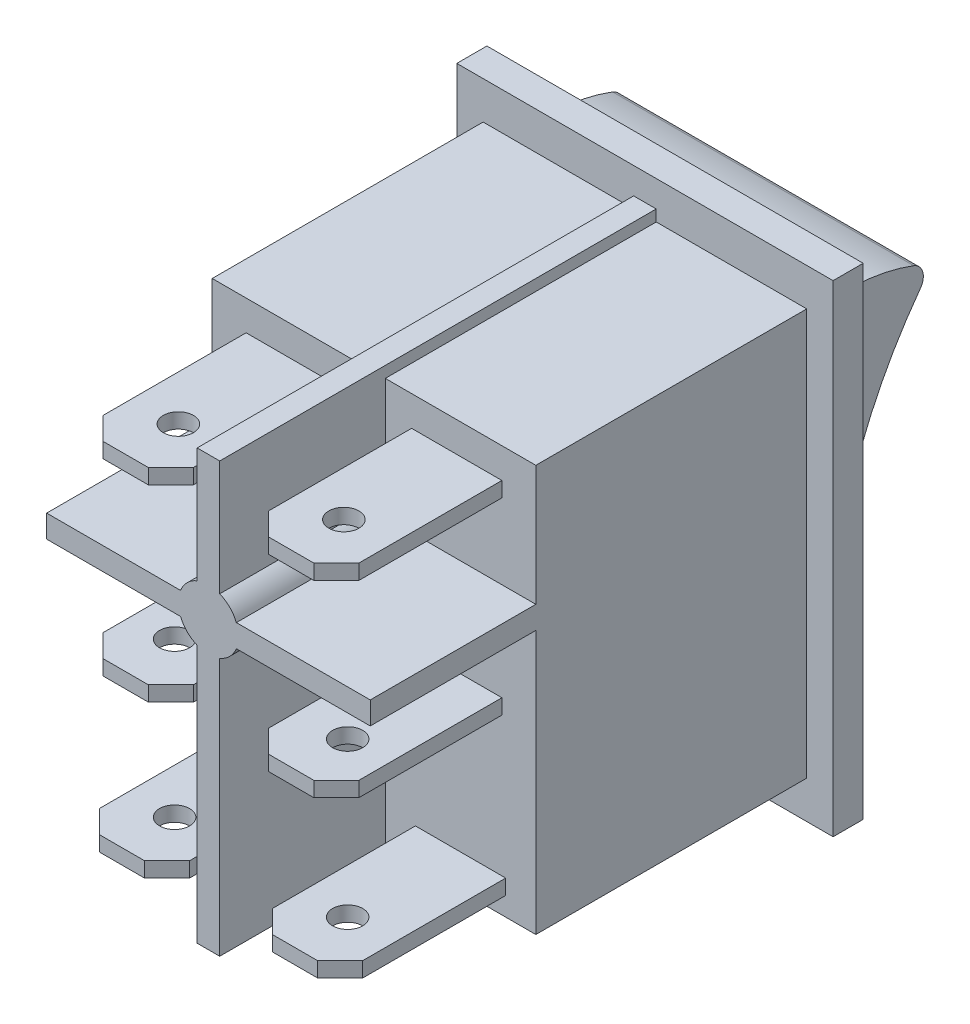
from build123d import *

# Parameters (mm, degrees)
SKETCH_1_W          = 25
SKETCH_1_H          = 32
EXTRUDE_1_DEPTH     = 2
SKETCH_2_W          = 21.5
SKETCH_2_H          = 27
EXTRUDE_2_DEPTH     = 18
SKETCH_3_W          = 1.5
SKETCH_3_H          = 28.5
EXTRUDE_3_DEPTH     = 29
SKETCH_4_W          = 21.5
SKETCH_4_H          = 1.5
EXTRUDE_4_DEPTH     = 11
SKETCH_6_R          = 2
EXTRUDE_5_DEPTH     = 11
SKETCH_7_W          = 6
SKETCH_7_H          = 1
EXTRUDE_6_DEPTH     = 11
SKETCH_8_R          = 1
CUT_EXTRUDE_1_DEPTH = 15
SKETCH_9_R          = 1
CUT_EXTRUDE_2_DEPTH = 5
CHAMFER_1_SIZE      = 1.5
SKETCH_10_W         = 20
SKETCH_10_H         = 25
CUT_EXTRUDE_3_DEPTH = 5
EXTRUDE_7_DEPTH     = 20


with BuildPart() as part:
    # Эскиз1 → Бобышка-Вытянуть1 (new body)
    with BuildSketch(Plane.XY):
        with Locations((12.5, 16)):
            Rectangle(SKETCH_1_W, SKETCH_1_H)
    extrude(amount=EXTRUDE_1_DEPTH)

    # Эскиз2 → Бобышка-Вытянуть2 (add)
    with BuildSketch(Plane.XY.offset(2)):
        with Locations((12.5, 16)):
            Rectangle(SKETCH_2_W, SKETCH_2_H)
    extrude(amount=EXTRUDE_2_DEPTH)

    # Эскиз3 → Бобышка-Вытянуть3 (add)
    with BuildSketch(Plane.XY.offset(2)):
        with Locations((12.5, 16)):
            Rectangle(SKETCH_3_W, SKETCH_3_H)
    extrude(amount=EXTRUDE_3_DEPTH)

    # Эскиз4 → Бобышка-Вытянуть4 (add)
    with BuildSketch(Plane.XY.offset(20)):
        with Locations((12.5, 20.75)):
            Rectangle(SKETCH_4_W, SKETCH_4_H)
    extrude(amount=EXTRUDE_4_DEPTH)

    # Эскиз6 → Бобышка-Вытянуть5 (add)
    with BuildSketch(Plane.XY.offset(31)):
        with Locations((12.5, 20.75)):
            Circle(SKETCH_6_R)
    extrude(amount=-EXTRUDE_5_DEPTH)

    # Эскиз7 → Бобышка-Вытянуть6 (add)
    with BuildSketch(Plane.XY.offset(20)):
        with Locations((7.002560395, 27)):
            Rectangle(SKETCH_7_W, SKETCH_7_H)
        with Locations((6.75, 4.25)):
            Rectangle(SKETCH_7_W, SKETCH_7_H)
        with Locations((7.002560395, 14.5)):
            Rectangle(SKETCH_7_W, SKETCH_7_H)
        with Locations((18.25, 4.25)):
            Rectangle(SKETCH_7_W, SKETCH_7_H)
        with Locations((17.997439605, 14.5)):
            Rectangle(SKETCH_7_W, SKETCH_7_H)
        with Locations((17.997439605, 27)):
            Rectangle(SKETCH_7_W, SKETCH_7_H)
    extrude(amount=EXTRUDE_6_DEPTH)

    # Эскиз8 → Вырез-Вытянуть1 (cut)
    with BuildSketch(Plane.XZ.offset(-3.75)):
        with Locations(Location((6.75, 27.5, 0), (0, 0, 270))):
            Circle(SKETCH_8_R)
        with Locations(Location((18.25, 27.5, 0), (0, 0, 270))):
            Circle(SKETCH_8_R)
    extrude(amount=-CUT_EXTRUDE_1_DEPTH, mode=Mode.SUBTRACT)

    # Эскиз9 → Вырез-Вытянуть2 (cut)
    with BuildSketch(Plane(origin=(0, 27.5, 0), x_dir=(1, 0, 0), z_dir=(0, 1, 0))):
        with Locations(Location((17.997439605, -27.5, 0), (0, 0, 270))):
            Circle(SKETCH_9_R)
        with Locations(Location((7.002560395, -27.5, 0), (0, 0, 270))):
            Circle(SKETCH_9_R)
    extrude(amount=-CUT_EXTRUDE_2_DEPTH, mode=Mode.SUBTRACT)

    # Фаска1
    chamfer_1_edges = [part.edges().sort_by_distance(p)[0] for p in [
        (4.002560395, 27, 31),
        (10.002560395, 27, 31),
        (9.75, 4.25, 31),
        (3.75, 4.25, 31),
        (10.002560395, 14.5, 31),
        (4.002560395, 14.5, 31),
        (21.25, 4.25, 31),
        (15.25, 4.25, 31),
        (20.997439605, 14.5, 31),
        (14.997439605, 14.5, 31),
        (14.997439605, 27, 31),
        (20.997439605, 27, 31),
    ]]
    chamfer(chamfer_1_edges, length=CHAMFER_1_SIZE)

    # Эскиз10 → Вырез-Вытянуть3 (cut)
    with BuildSketch(Plane(origin=(0, 0, 0), x_dir=(-1, 0, 0), z_dir=(0, 0, -1))):
        with Locations((-12.5, 16)):
            Rectangle(SKETCH_10_W, SKETCH_10_H)
    extrude(amount=-CUT_EXTRUDE_3_DEPTH, mode=Mode.SUBTRACT)

    # Эскиз12 → Бобышка-Вытянуть7 (add)
    with BuildSketch(Plane.ZY.offset(-22.5)):
        with BuildLine():
            Line((5, 5.26592597), (5, 26.73407403))
            ThreePointArc((5, 26.73407403), (-0.317848235, 28.452595927), (-5.853095184, 27.68196724))
            ThreePointArc((-5.853095184, 27.68196724), (-6.456920042, 27.028650367), (-6.301261639, 26.152752053))
            ThreePointArc((-6.301261639, 26.152752053), (-1.405439464, 16), (-0.568969813, 4.759547716))
            ThreePointArc((-0.568969813, 4.759547716), (-0.265824787, 3.923168323), (0.583761316, 3.659291744))
            ThreePointArc((0.583761316, 3.659291744), (2.86806198, 4.253205313), (5, 5.26592597))
        make_face()
    extrude(amount=EXTRUDE_7_DEPTH)


solid = part.part
